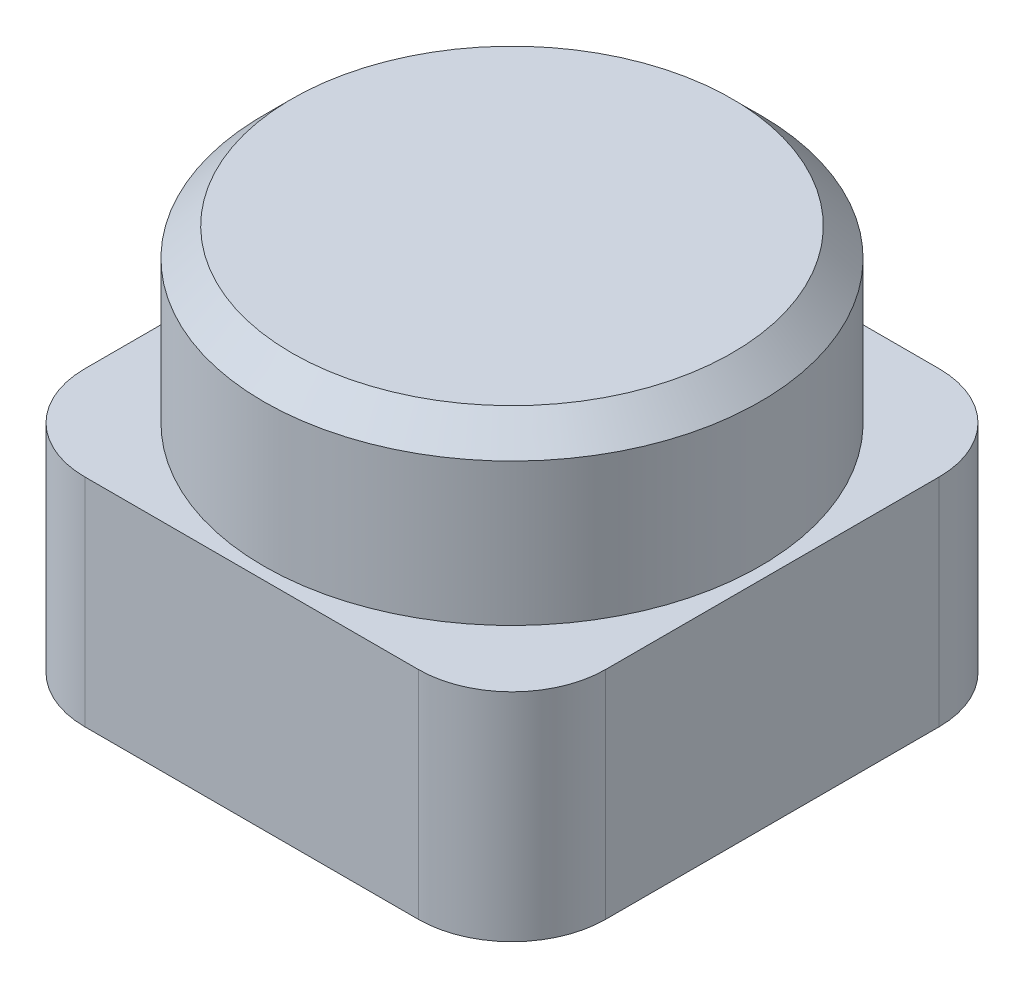
from build123d import *

# Parameters (mm, degrees)
SKETCH1_W           = 55.6
SKETCH1_H           = 55.6
BOSS_EXTRUDE1_DEPTH = 23.1
FILLET1_R           = 10
SKETCH2_R           = 1
SCREW_HOLES_DEPTH   = 4
SKETCH3_R           = 26.5
BOSS_EXTRUDE2_DEPTH = 18.2
CHAMFER1_SIZE       = 3


with BuildPart() as part:
    # Sketch1 → Boss-Extrude1 (new body)
    with BuildSketch(Plane(origin=(0, 0, 0), x_dir=(1, 0, 0), z_dir=(0, 1, 0))):
        with Locations((27.8, 27.8)):
            Rectangle(SKETCH1_W, SKETCH1_H)
    extrude(amount=BOSS_EXTRUDE1_DEPTH)

    # Fillet1
    fillet1_edges = [part.edges().sort_by_distance(p)[0] for p in [
        (0, 11.55, -55.6),
        (55.6, 11.55, -55.6),
        (55.6, 11.55, 0),
        (0, 11.55, 0),
    ]]
    fillet(fillet1_edges, radius=FILLET1_R)

    # Sketch2 → Screw Holes (cut)
    with BuildSketch(Plane.XZ):
        with Locations(Location((6.3, -6.3, 0), (0, 0, 270))):
            Circle(SKETCH2_R)
        with Locations(Location((49.3, -6.3, 0), (0, 0, 270))):
            Circle(SKETCH2_R)
        with Locations(Location((49.3, -49.3, 0), (0, 0, 270))):
            Circle(SKETCH2_R)
        with Locations(Location((6.3, -49.3, 0), (0, 0, 270))):
            Circle(SKETCH2_R)
    extrude(amount=-SCREW_HOLES_DEPTH, mode=Mode.SUBTRACT)

    # Sketch3 → Boss-Extrude2 (add)
    with BuildSketch(Plane(origin=(0, 23.1, 0), x_dir=(1, 0, 0), z_dir=(0, 1, 0))):
        with Locations(Location((27.8, 27.8, 0), (0, 0, 270))):
            Circle(SKETCH3_R)
    extrude(amount=BOSS_EXTRUDE2_DEPTH)

    # Chamfer1
    chamfer1_edges = [part.edges().sort_by_distance(p)[0] for p in [
        (27.8, 41.3, -54.3),
    ]]
    chamfer(chamfer1_edges, length=CHAMFER1_SIZE)


solid = part.part
